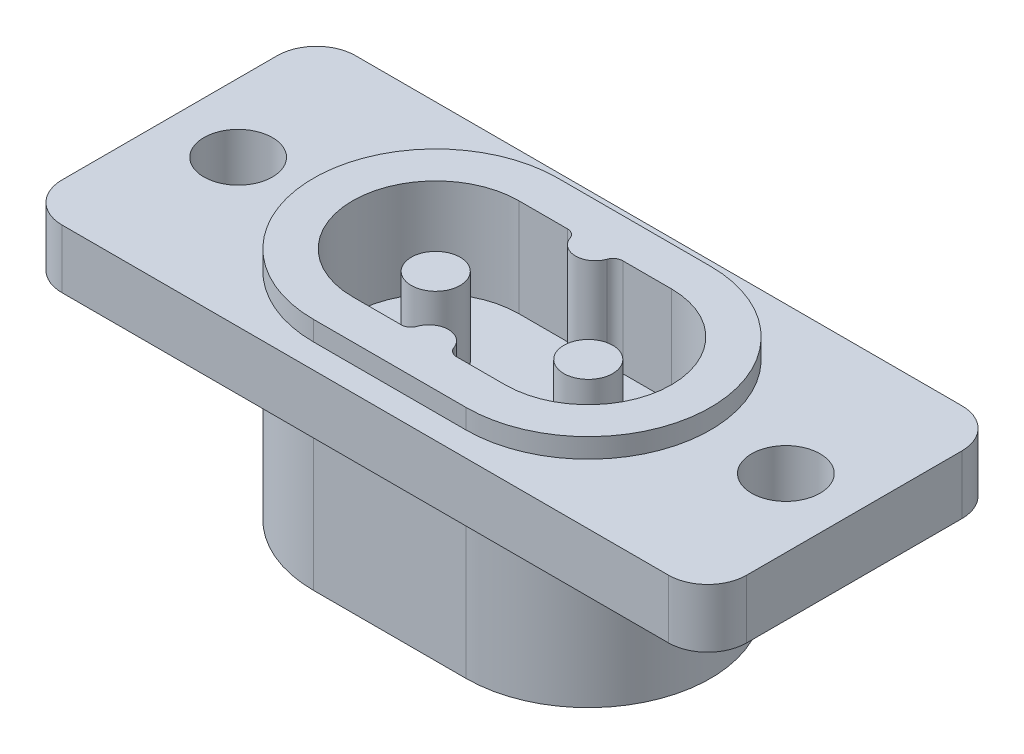
from build123d import *

# Parameters (mm, degrees)
SKETCH_1_W           = 35
SKETCH_1_H           = 15
EXTRUDE_1_DEPTH      = 3
EXTRUDE_2_DEPTH      = 1
EXTRUDE_2_DEPTH_BACK = 11
SKETCH_3_R           = 1.75
CUT_EXTRUDE_1_DEPTH  = 22.988633427
CUT_EXTRUDE_2_DEPTH  = 5
SKETCH_6_R           = 1.25
EXTRUDE_3_DEPTH      = 4
FILLET_1_R           = 2
SKETCH_7_W           = 1.104079178
SKETCH_7_H           = 3.426452622
SKETCH_7_W_2         = 1.066007483
EXTRUDE_4_DEPTH      = 3


with BuildPart() as part:
    # 草图1 → 凸台-拉伸1 (new body)
    with BuildSketch(Plane(origin=(0, 0, 0), x_dir=(1, 0, 0), z_dir=(0, 1, 0))):
        Rectangle(SKETCH_1_W, SKETCH_1_H)
    extrude(amount=EXTRUDE_1_DEPTH)

    # 草图2 → 凸台-拉伸2 (add, two sides: drawn at the far end of the back side and taken through both)
    with BuildSketch(Plane(origin=(0, 3, 0), x_dir=(1, 0, 0), z_dir=(0, 1, 0)).offset(-EXTRUDE_2_DEPTH_BACK)):
        with BuildLine():
            Line((-3.9, 6.25), (3.9, 6.25))
            ThreePointArc((3.9, 6.25), (10.15, 0), (3.9, -6.25))
            Line((3.9, -6.25), (-3.9, -6.25))
            ThreePointArc((-3.9, -6.25), (-10.15, 0), (-3.9, 6.25))
        make_face()
    extrude(amount=EXTRUDE_2_DEPTH + EXTRUDE_2_DEPTH_BACK)

    # 草图3 → 切除-拉伸1 (cut, through all)
    with BuildSketch(Plane(origin=(0, 3, 0), x_dir=(1, 0, 0), z_dir=(0, 1, 0))):
        with Locations(Location((-14, 0, 0), (0, 0, 270))):
            Circle(SKETCH_3_R)
        with Locations(Location((14, 0, 0), (0, 0, 270))):
            Circle(SKETCH_3_R)
    extrude(amount=-CUT_EXTRUDE_1_DEPTH, mode=Mode.SUBTRACT)

    # 草图5 → 切除-拉伸2 (cut)
    with BuildSketch(Plane(origin=(0, 4, 0), x_dir=(1, 0, 0), z_dir=(0, 1, 0))):
        with BuildLine():
            Line((-1.414213562, 4.25), (-3.9, 4.25))
            ThreePointArc((-3.9, 4.25), (-8.15, 0), (-3.9, -4.25))
            Line((-3.9, -4.25), (-1.414213562, -4.25))
            ThreePointArc((-1.414213562, -4.25), (-1.125538428, -4.15824829), (-0.942809042, -3.916666667))
            ThreePointArc((-0.942809042, -3.916666667), (0, -3.25), (0.942809042, -3.916666667))
            ThreePointArc((0.942809042, -3.916666667), (1.125538428, -4.15824829), (1.414213562, -4.25))
            Line((1.414213562, -4.25), (3.9, -4.25))
            ThreePointArc((3.9, -4.25), (8.15, 0), (3.9, 4.25))
            Line((3.9, 4.25), (1.414213562, 4.25))
            ThreePointArc((1.414213562, 4.25), (1.125538428, 4.15824829), (0.942809042, 3.916666667))
            ThreePointArc((0.942809042, 3.916666667), (0, 3.25), (-0.942809042, 3.916666667))
            ThreePointArc((-0.942809042, 3.916666667), (-1.125538428, 4.15824829), (-1.414213562, 4.25))
        make_face()
    extrude(amount=-CUT_EXTRUDE_2_DEPTH, mode=Mode.SUBTRACT)

    # 草图6 → 凸台-拉伸3 (add)
    with BuildSketch(Plane(origin=(0, -1, 0), x_dir=(1, 0, 0), z_dir=(0, 1, 0))):
        with Locations(Location((-3.9, 0, 0), (0, 0, 270))):
            Circle(SKETCH_6_R)
        with Locations(Location((3.9, 0, 0), (0, 0, 270))):
            Circle(SKETCH_6_R)
    extrude(amount=EXTRUDE_3_DEPTH)

    # 圆角1
    fillet_1_edges = [part.edges().sort_by_distance(p)[0] for p in [
        (17.5, 1.5, 7.5),
        (-17.5, 1.5, 7.5),
        (-17.5, 1.5, -7.5),
        (17.5, 1.5, -7.5),
    ]]
    fillet(fillet_1_edges, radius=FILLET_1_R)

    # 草图7 → 凸台-拉伸4 (add)
    with BuildSketch(Plane.XZ.offset(8)):
        with Locations((-4.16885069, 0.171322631)):
            Rectangle(SKETCH_7_W, SKETCH_7_H)
        with Locations((3.769097885, 0.171322631)):
            Rectangle(SKETCH_7_W_2, SKETCH_7_H)
    extrude(amount=EXTRUDE_4_DEPTH)


solid = part.part
